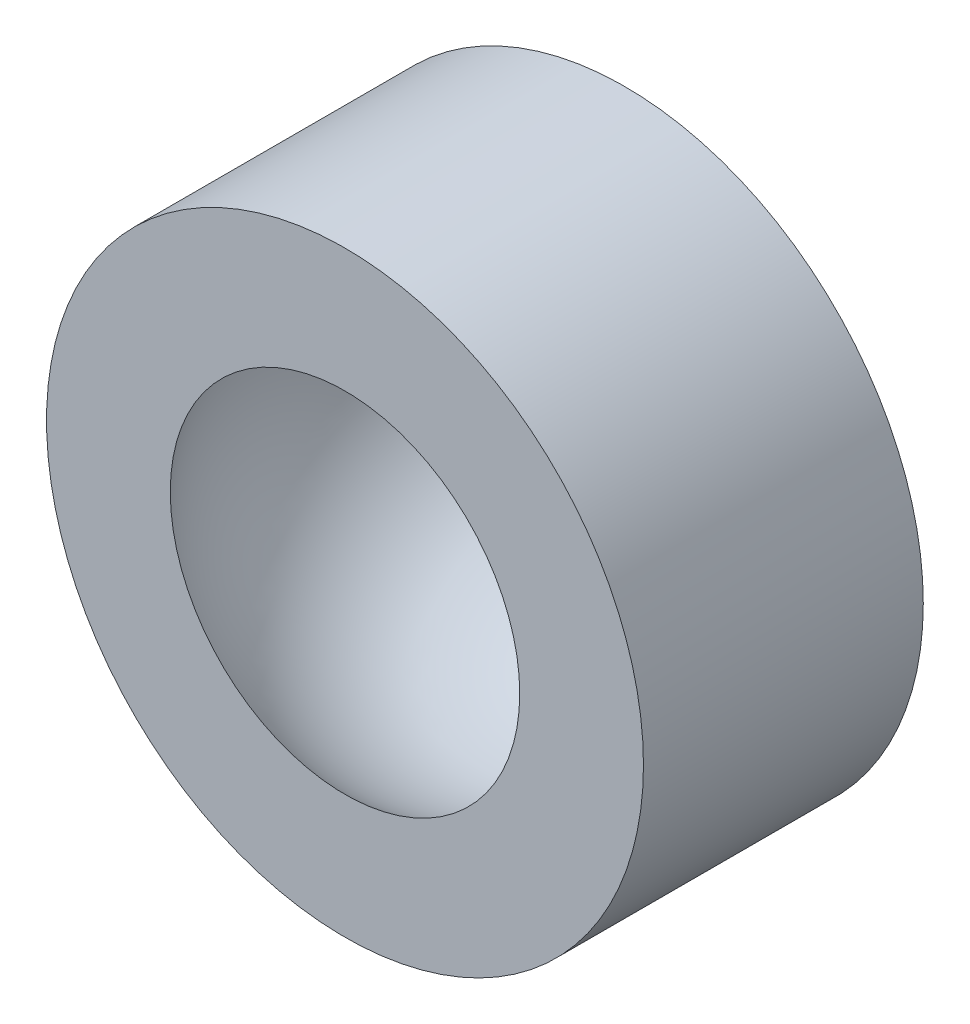
from build123d import *

# Parameters (mm, degrees)
BOSS_EXTRUDE1_DEPTH      = 1.875
BOSS_EXTRUDE1_DEPTH_BACK = 1.875
SKETCH1_R                = 4
SKETCH1_R_2              = 2
SCALE1_SCALE             = 18


with BuildPart() as part:
    # Sketch1 → Boss-Extrude1 (new, two sides: drawn at the far end of the back side and taken through both)
    with BuildSketch(Plane.XY.offset(-BOSS_EXTRUDE1_DEPTH_BACK)):
        Circle(SKETCH1_R)
        Circle(SKETCH1_R_2, mode=Mode.SUBTRACT)
    extrude(amount=BOSS_EXTRUDE1_DEPTH + BOSS_EXTRUDE1_DEPTH_BACK)


with BuildPart() as body_2:
    # Sketch2 → Revolve1 (revolve)
    with BuildSketch(Plane.XY):
        with BuildLine():
            Line((0, 3), (0, -3))
            ThreePointArc((0, -3), (-3, 0), (0, 3))
        make_face()
    revolve(axis=Axis((0, 3, 0), (0, -1, 0)))


with BuildPart() as part_1:
    add(part.part)

    # Combine1: cut body 2
    add(body_2.part, mode=Mode.SUBTRACT)


with BuildPart() as part_2:
    # Scale1: scaled about (9e-09, -1e-09, 0)
    add(part_1.part.scale(SCALE1_SCALE).moved(Location((-1.53e-07, 1.7e-08, 0))))


solid = part_2.part
